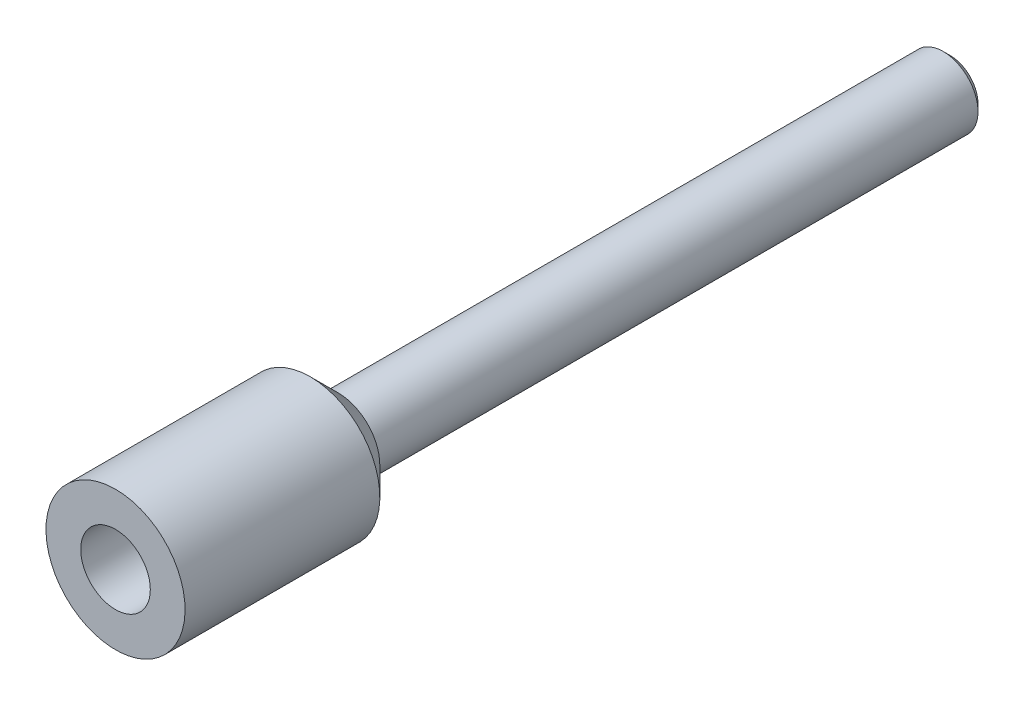
from build123d import *

# Parameters (mm, degrees)
M6X1_0_1_D     = 5
M6X1_0_1_DEPTH = 12
M6X1_0_1_TIP   = 1.502151548
CHAMFER_1_SIZE = 0.5


with BuildPart() as part:
    # 스케치1 → 회전1 (revolve)
    with BuildSketch(Plane(origin=(0, 0, 0), x_dir=(0, 0, -1), z_dir=(1, 0, 0))):
        Polygon((0, 0), (0, 5), (14, 5), (16, 3), (16, 2.5), (60, 2.5), (60, 0), align=None)
    revolve(axis=Axis((0, 0, -60), (0, 0, 1)))

    # M6x1.0 나사 구멍1
    with Locations(Plane.XY):
        with Locations((0, 0)):
            Hole(M6X1_0_1_D / 2, depth=M6X1_0_1_DEPTH)
            with Locations((0, 0, -(M6X1_0_1_DEPTH + M6X1_0_1_TIP / 2))):  # 118° drill point
                Cone(0, M6X1_0_1_D / 2, M6X1_0_1_TIP, mode=Mode.SUBTRACT)

    # 모따기1
    chamfer_1_edges = [part.edges().sort_by_distance(p)[0] for p in [
        (0, -2.5, -60),
    ]]
    chamfer(chamfer_1_edges, length=CHAMFER_1_SIZE)


solid = part.part
